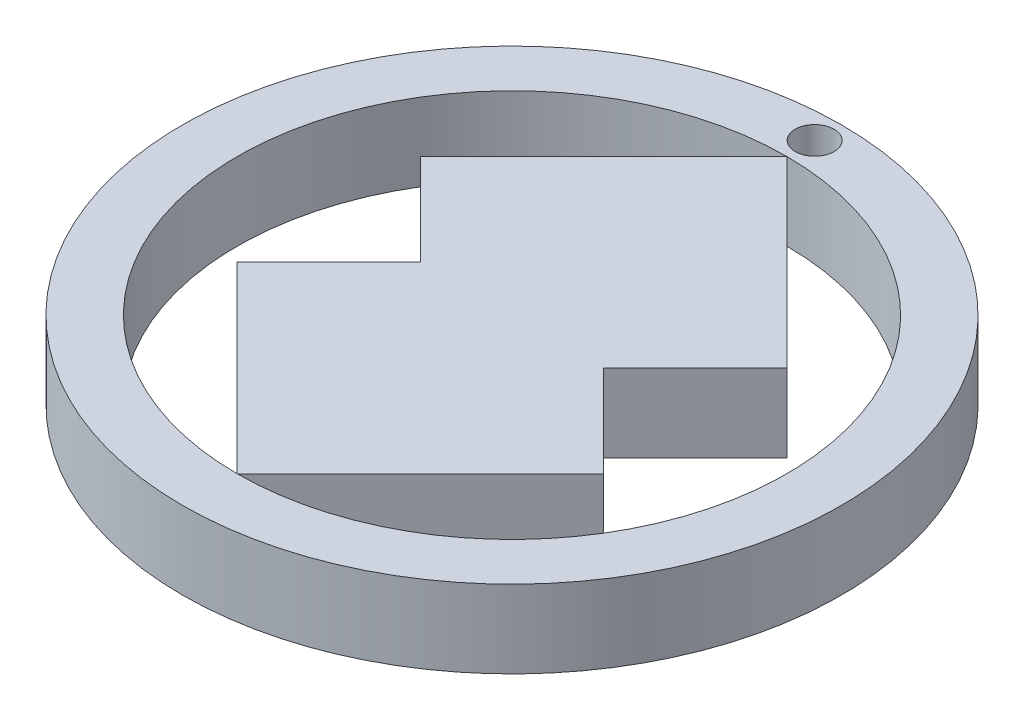
from build123d import *

# Parameters (mm, degrees)
BOSS_EXTRUDE1_DEPTH = 6
SKETCH2_R           = 25.439986865
SKETCH2_R_2         = 21.213203436
BOSS_EXTRUDE2_DEPTH = 6
SKETCH3_R           = 1.5
CUT_EXTRUDE1_DEPTH  = 6


with BuildPart() as part:
    # Sketch1 → Boss-Extrude1 (new body)
    with BuildSketch(Plane(origin=(0, 0, 0), x_dir=(1, 0, 0), z_dir=(0, 1, 0))):
        Polygon((-14.142135624, 14.142135624), (0, 28.284271247), (14.142135624, 14.142135624), (7.071067812, 7.071067812), (14.142135624, 0), (0, -14.142135624), (-14.142135624, 0), (-7.071067812, 7.071067812), align=None)
    extrude(amount=BOSS_EXTRUDE1_DEPTH)


with BuildPart() as body_2:
    # Sketch2 → Boss-Extrude2 (new body)
    with BuildSketch(Plane(origin=(0, 6, 0), x_dir=(1, 0, 0), z_dir=(0, 1, 0))):
        with Locations(Location((0, 7.071067812, 0), (0, 0, 270))):
            Circle(SKETCH2_R)
        with Locations(Location((0, 7.071067812, 0), (0, 0, 270))):
            Circle(SKETCH2_R_2, mode=Mode.SUBTRACT)
    extrude(amount=-BOSS_EXTRUDE2_DEPTH)

    # Sketch3 → Cut-Extrude1 (cut)
    with BuildSketch(Plane(origin=(0, 6, 0), x_dir=(1, 0, 0), z_dir=(0, 1, 0))):
        with Locations(Location((0, 30.43250968, 0), (0, 0, 270))):
            Circle(SKETCH3_R)
    extrude(amount=-CUT_EXTRUDE1_DEPTH, mode=Mode.SUBTRACT)


solid = Compound([part.part, body_2.part])
